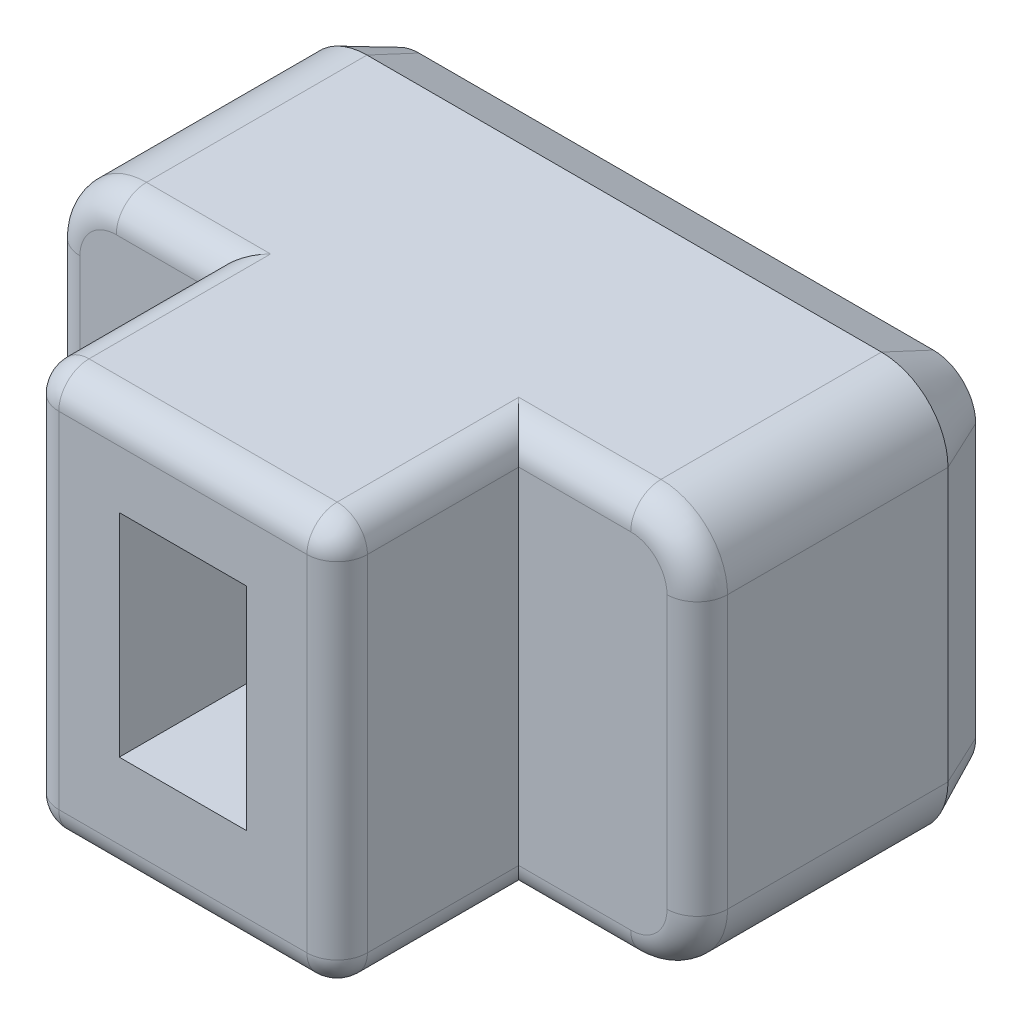
from build123d import *

# Parameters (mm, degrees)
BOSS_EXTRU_1_DEPTH      = 8
ESQUISSE3_W             = 2.1
ESQUISSE3_H             = 3.5
ENL_V_MAT_EXTRU_1_DEPTH = 3
ESQUISSE4_OUTSIDE_W     = 15.69
ESQUISSE4_OUTSIDE_H     = 11.69
ESQUISSE4_OUTSIDE_W_2   = 5.1
ESQUISSE4_OUTSIDE_H_2   = 6.7
ENL_V_MAT_EXTRU_2_DEPTH = 3
CONG_1_R                = 0.5
CHANFREIN1_SIZE         = 0.4
CHANFREIN1_SIZE2        = 0.857802768


with BuildPart() as part:
    # Esquisse2 → Boss.-Extru.1 (new body)
    with BuildSketch(Plane.XY):
        with BuildLine():
            Line((1.1, 0), (9.6, 0))
            ThreePointArc((9.6, 0), (10.377817459, 0.322182541), (10.7, 1.1))
            Line((10.7, 1.1), (10.7, 5.6))
            ThreePointArc((10.7, 5.6), (10.377817459, 6.377817459), (9.6, 6.7))
            Line((9.6, 6.7), (1.1, 6.7))
            ThreePointArc((1.1, 6.7), (0.322182541, 6.377817459), (0, 5.6))
            Line((0, 5.6), (0, 1.1))
            ThreePointArc((0, 1.1), (0.322182541, 0.322182541), (1.1, 0))
        make_face()
    extrude(amount=BOSS_EXTRU_1_DEPTH)

    # Esquisse3 → Enlèv. mat.-Extru.1 (cut)
    with BuildSketch(Plane.XY.offset(8)):
        with Locations((5.2, 3.5)):
            Rectangle(ESQUISSE3_W, ESQUISSE3_H)
    extrude(amount=-ENL_V_MAT_EXTRU_1_DEPTH, mode=Mode.SUBTRACT)

    # Esquisse4 outside → Enlèv. mat.-Extru.2 (cut)
    with BuildSketch(Plane.XY.offset(8)):
        with Locations((5.35, 3.35)):
            Rectangle(ESQUISSE4_OUTSIDE_W, ESQUISSE4_OUTSIDE_H)
        with Locations((5.2, 3.35)):
            Rectangle(ESQUISSE4_OUTSIDE_W_2, ESQUISSE4_OUTSIDE_H_2, mode=Mode.SUBTRACT)
    extrude(amount=-ENL_V_MAT_EXTRU_2_DEPTH, mode=Mode.SUBTRACT)

    # Congé1
    cong_1_edges = [part.edges().sort_by_distance(p)[0] for p in [
        (5.2, 6.7, 8),
        (5.2, 0, 8),
        (10.7, 3.35, 5),
        (1.875, 6.7, 5),
        (0.322182541, 6.377817459, 5),
        (0, 3.35, 5),
        (0.322182541, 0.322182541, 5),
        (1.875, 0, 5),
        (8.675, 0, 5),
        (10.377817459, 0.322182541, 5),
        (10.377817459, 6.377817459, 5),
        (8.675, 6.7, 5),
        (7.75, 6.7, 6.5),
        (7.75, 3.35, 8),
        (7.75, 0, 6.5),
        (2.65, 0, 6.5),
        (2.65, 3.35, 8),
        (2.65, 6.7, 6.5),
    ]]
    fillet(cong_1_edges, radius=CONG_1_R)

    # Chanfrein1
    chanfrein1_edges = [part.edges().sort_by_distance(p)[0] for p in [
        (5.35, 6.7, 0),
        (10.377817459, 6.377817459, 0),
        (10.7, 3.35, 0),
        (10.377817459, 0.322182541, 0),
        (5.35, 0, 0),
        (0.322182541, 0.322182541, 0),
        (0, 3.35, 0),
        (0.322182541, 6.377817459, 0),
    ]]
    chanfrein1_side = [part.faces().sort_by_distance(p)[0] for p in [
        (5.35, 3.35, 0),
    ]]
    chamfer(chanfrein1_edges, length=CHANFREIN1_SIZE, length2=CHANFREIN1_SIZE2, reference=chanfrein1_side[0])


solid = part.part
